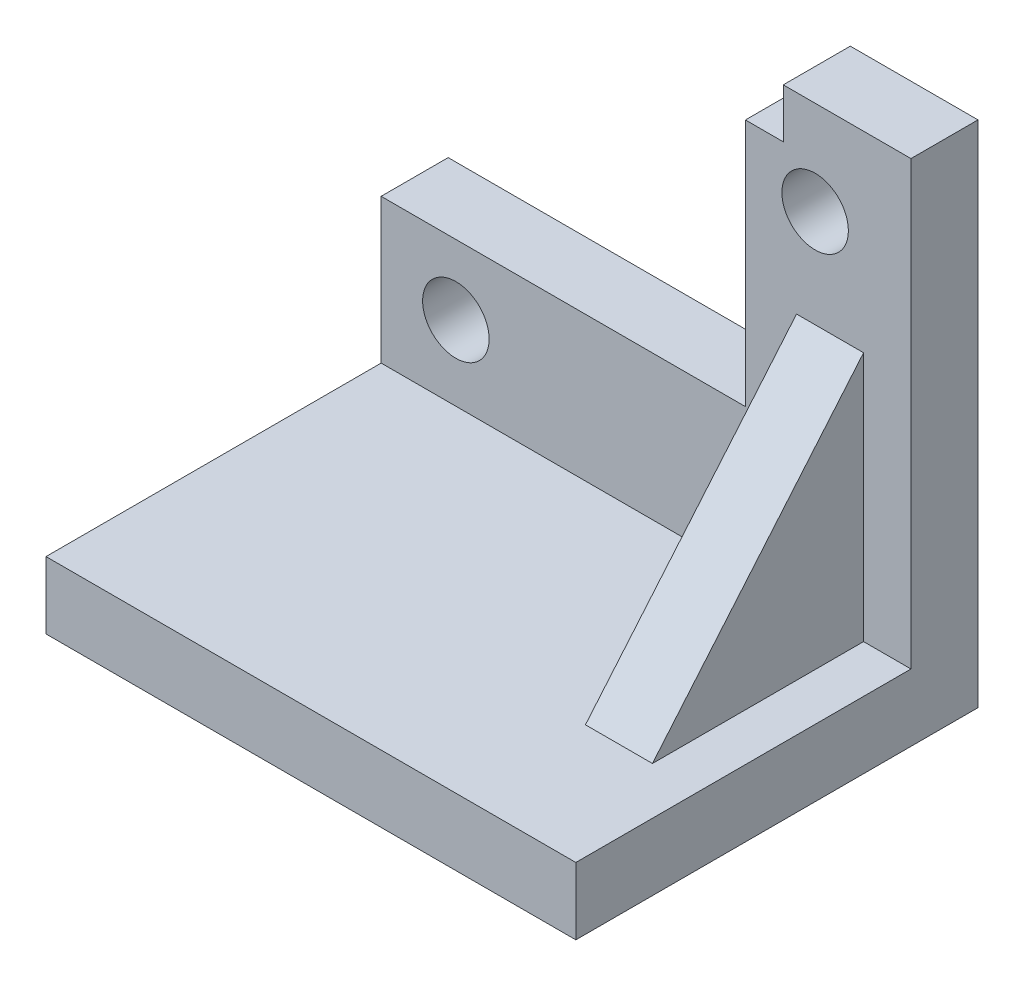
from build123d import *

# Parameters (mm, degrees)
SKETCH2_R           = 1.5748
BOSS_EXTRUDE1_DEPTH = 3.175
SKETCH5_W           = 24.098
SKETCH5_H           = 3.175
BOSS_EXTRUDE2_DEPTH = 19.05
SKETCH7_W           = 1
SKETCH7_H           = 6.842
BOSS_EXTRUDE3_DEPTH = 3.175
SKETCH8_W           = 1
SKETCH8_H           = 3.175
BOSS_EXTRUDE4_DEPTH = 19.05
SKETCH9_W           = 3.175
SKETCH9_H           = 11.85042952
BOSS_EXTRUDE5_DEPTH = 10
CUT_EXTRUDE1_DEPTH  = 33.332180825


with BuildPart() as part:
    # Sketch2 → Boss-Extrude1 (new body)
    with BuildSketch(Plane.XY):
        Polygon((4.395213829, 10.321811953), (4.395213829, 7.827388121), (4.395213829, -1.438404904), (-11.860786171, -1.438404904), (-11.860786171, -8.280404904), (12.237213829, -8.280404904), (12.237213829, 12.658595096), (7.697213829, 12.658595096), (6.188170382, 12.658595096), (6.188170382, 10.321811953), align=None)
        with Locations((-9.320786171, -4.740404904)):
            Circle(SKETCH2_R, mode=Mode.SUBTRACT)
        with Locations((7.697213829, 8.213595096)):
            Circle(SKETCH2_R, mode=Mode.SUBTRACT)
    extrude(amount=BOSS_EXTRUDE1_DEPTH)

    # Sketch5 → Boss-Extrude2 (add)
    with BuildSketch(Plane(origin=(0, 0, 0), x_dir=(-1, 0, 0), z_dir=(0, 0, -1))):
        with Locations((-0.188213829, -9.867904904)):
            Rectangle(SKETCH5_W, SKETCH5_H)
    extrude(amount=-BOSS_EXTRUDE2_DEPTH)

    # Sketch7 → Boss-Extrude3 (add)
    with BuildSketch(Plane.XY.offset(3.175)):
        with Locations((-12.360786171, -4.859404904)):
            Rectangle(SKETCH7_W, SKETCH7_H)
    extrude(amount=-BOSS_EXTRUDE3_DEPTH)

    # Sketch8 → Boss-Extrude4 (add)
    with BuildSketch(Plane.XY.offset(19.05)):
        with Locations((-12.360786171, -9.867904904)):
            Rectangle(SKETCH8_W, SKETCH8_H)
    extrude(amount=-BOSS_EXTRUDE4_DEPTH)

    # Sketch9 → Boss-Extrude5 (add)
    with BuildSketch(Plane.XY.offset(3.175)):
        with Locations((8.404008836, -2.355190144)):
            Rectangle(SKETCH9_W, SKETCH9_H)
    extrude(amount=BOSS_EXTRUDE5_DEPTH)

    # Sketch10 → Cut-Extrude1 (cut, through all)
    with BuildSketch(Plane(origin=(9.991508836, 0, 0), x_dir=(0, 0, -1), z_dir=(1, 0, 0))):
        Polygon((-3.175, 3.570024616), (-13.175, -8.280404904), (-13.175, 3.570024616), align=None)
    extrude(amount=-CUT_EXTRUDE1_DEPTH, mode=Mode.SUBTRACT)


solid = part.part
